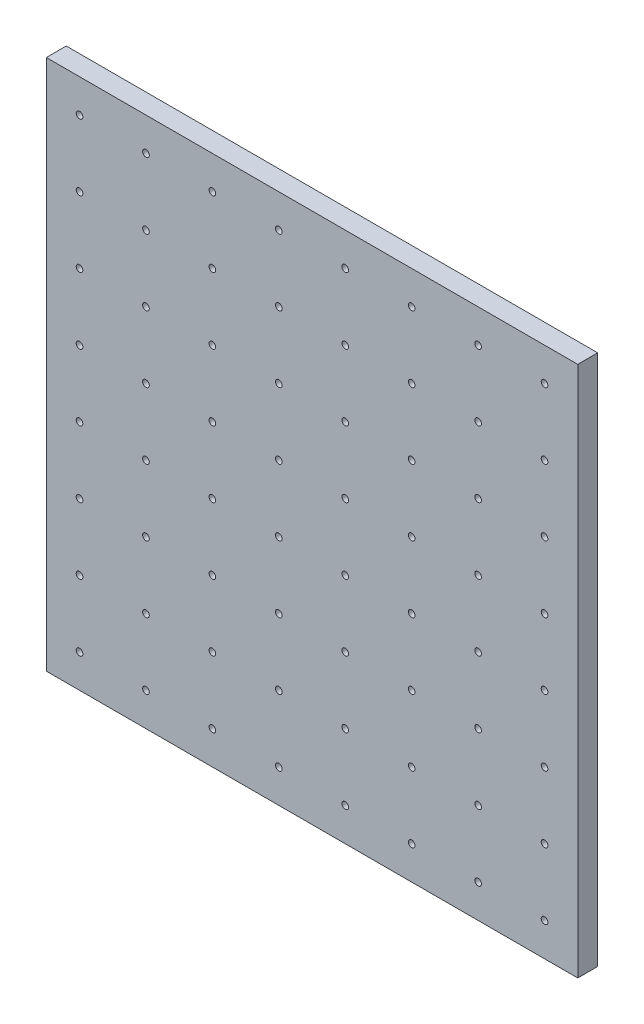
from build123d import *

# Parameters (mm, degrees)
SKETCH1_W           = 160
SKETCH1_H           = 160
BOSS_EXTRUDE1_DEPTH = 7
SKETCH2_R           = 1
CUT_EXTRUDE1_DEPTH  = 3
SKETCH7_W           = 1
SKETCH7_H           = 160
CUT_EXTRUDE2_DEPTH  = 300


with BuildPart() as part:
    # Sketch1 → Boss-Extrude1 (new body)
    with BuildSketch(Plane.XY):
        with Locations((80, 80)):
            Rectangle(SKETCH1_W, SKETCH1_H)
    extrude(amount=BOSS_EXTRUDE1_DEPTH)

    # Sketch2 → Cut-Extrude1 (cut)
    with BuildSketch(Plane.XY.offset(7)):
        with Locations((10, 150)):
            Circle(SKETCH2_R)
        with Locations((30, 150)):
            Circle(SKETCH2_R)
        with Locations((50, 150)):
            Circle(SKETCH2_R)
        with Locations((70, 150)):
            Circle(SKETCH2_R)
        with Locations((90, 150)):
            Circle(SKETCH2_R)
        with Locations((110, 150)):
            Circle(SKETCH2_R)
        with Locations((130, 150)):
            Circle(SKETCH2_R)
        with Locations((150, 150)):
            Circle(SKETCH2_R)
        with Locations((30, 130)):
            Circle(SKETCH2_R)
        with Locations((10, 130)):
            Circle(SKETCH2_R)
        with Locations((50, 130)):
            Circle(SKETCH2_R)
        with Locations((70, 130)):
            Circle(SKETCH2_R)
        with Locations((90, 130)):
            Circle(SKETCH2_R)
        with Locations((110, 130)):
            Circle(SKETCH2_R)
        with Locations((130, 130)):
            Circle(SKETCH2_R)
        with Locations((150, 130)):
            Circle(SKETCH2_R)
        with Locations((30, 110)):
            Circle(SKETCH2_R)
        with Locations((10, 110)):
            Circle(SKETCH2_R)
        with Locations((50, 110)):
            Circle(SKETCH2_R)
        with Locations((70, 110)):
            Circle(SKETCH2_R)
        with Locations((90, 110)):
            Circle(SKETCH2_R)
        with Locations((110, 110)):
            Circle(SKETCH2_R)
        with Locations((130, 110)):
            Circle(SKETCH2_R)
        with Locations((150, 110)):
            Circle(SKETCH2_R)
        with Locations((30, 90)):
            Circle(SKETCH2_R)
        with Locations((10, 90)):
            Circle(SKETCH2_R)
        with Locations((50, 90)):
            Circle(SKETCH2_R)
        with Locations((70, 90)):
            Circle(SKETCH2_R)
        with Locations((90, 90)):
            Circle(SKETCH2_R)
        with Locations((110, 90)):
            Circle(SKETCH2_R)
        with Locations((130, 90)):
            Circle(SKETCH2_R)
        with Locations((150, 90)):
            Circle(SKETCH2_R)
        with Locations((30, 70)):
            Circle(SKETCH2_R)
        with Locations((10, 70)):
            Circle(SKETCH2_R)
        with Locations((50, 70)):
            Circle(SKETCH2_R)
        with Locations((70, 70)):
            Circle(SKETCH2_R)
        with Locations((90, 70)):
            Circle(SKETCH2_R)
        with Locations((110, 70)):
            Circle(SKETCH2_R)
        with Locations((130, 70)):
            Circle(SKETCH2_R)
        with Locations((150, 70)):
            Circle(SKETCH2_R)
        with Locations((30, 50)):
            Circle(SKETCH2_R)
        with Locations((10, 50)):
            Circle(SKETCH2_R)
        with Locations((50, 50)):
            Circle(SKETCH2_R)
        with Locations((70, 50)):
            Circle(SKETCH2_R)
        with Locations((90, 50)):
            Circle(SKETCH2_R)
        with Locations((110, 50)):
            Circle(SKETCH2_R)
        with Locations((130, 50)):
            Circle(SKETCH2_R)
        with Locations((150, 50)):
            Circle(SKETCH2_R)
        with Locations((30, 30)):
            Circle(SKETCH2_R)
        with Locations((10, 30)):
            Circle(SKETCH2_R)
        with Locations((50, 30)):
            Circle(SKETCH2_R)
        with Locations((70, 30)):
            Circle(SKETCH2_R)
        with Locations((90, 30)):
            Circle(SKETCH2_R)
        with Locations((110, 30)):
            Circle(SKETCH2_R)
        with Locations((130, 30)):
            Circle(SKETCH2_R)
        with Locations((150, 30)):
            Circle(SKETCH2_R)
        with Locations((30, 10)):
            Circle(SKETCH2_R)
        with Locations((10, 10)):
            Circle(SKETCH2_R)
        with Locations((50, 10)):
            Circle(SKETCH2_R)
        with Locations((70, 10)):
            Circle(SKETCH2_R)
        with Locations((90, 10)):
            Circle(SKETCH2_R)
        with Locations((110, 10)):
            Circle(SKETCH2_R)
        with Locations((130, 10)):
            Circle(SKETCH2_R)
        with Locations((150, 10)):
            Circle(SKETCH2_R)
    extrude(amount=-CUT_EXTRUDE1_DEPTH, mode=Mode.SUBTRACT)

    # Sketch7 → Cut-Extrude2 (cut)
    with BuildSketch(Plane.ZY):
        with Locations((0.5, 80)):
            Rectangle(SKETCH7_W, SKETCH7_H)
    extrude(amount=-CUT_EXTRUDE2_DEPTH, mode=Mode.SUBTRACT)


solid = part.part
